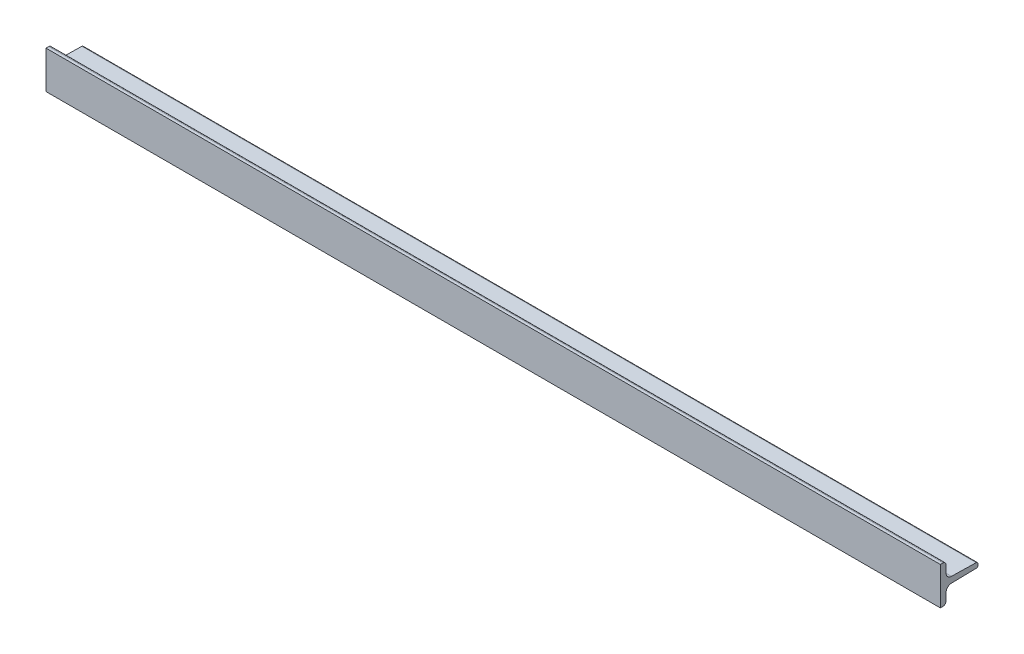
from build123d import *

# Parameters (mm, degrees)
T_SECTION_T_20_X_20_1_DEPTH = 475


with BuildPart() as part:
    # Sketch12 → T section T 20 X 20(1) (new body)
    with BuildSketch(Plane.YZ):
        with BuildLine():
            Line((-10, 20), (10, 20))
            Line((10, 20), (10, 18.570314587))
            ThreePointArc((10, 18.570314587), (9.571214338, 17.520314662), (8.530000209, 17.070614622))
            Line((8.530000209, 17.070614622), (4.520436432, 16.990406743))
            ThreePointArc((4.520436432, 16.990406743), (2.459116507, 16.112327155), (1.581036919, 14.05100723))
            Line((1.581036919, 14.05100723), (1.319562646, 0.97999986))
            ThreePointArc((1.319562646, 0.97999986), (1.019762619, 0.285857108), (0.319762669, 0))
            Line((0.319762669, 0), (-0.319762669, 0))
            ThreePointArc((-0.319762669, 0), (-1.019762619, 0.285857108), (-1.319562646, 0.97999986))
            Line((-1.319562646, 0.97999986), (-1.581036919, 14.05100723))
            ThreePointArc((-1.581036919, 14.05100723), (-2.459116507, 16.112327155), (-4.520436432, 16.990406743))
            Line((-4.520436432, 16.990406743), (-8.530000209, 17.070614622))
            ThreePointArc((-8.530000209, 17.070614622), (-9.571214338, 17.520314662), (-10, 18.570314587))
            Line((-10, 18.570314587), (-10, 20))
        make_face()
    extrude(amount=T_SECTION_T_20_X_20_1_DEPTH)


solid = part.part
